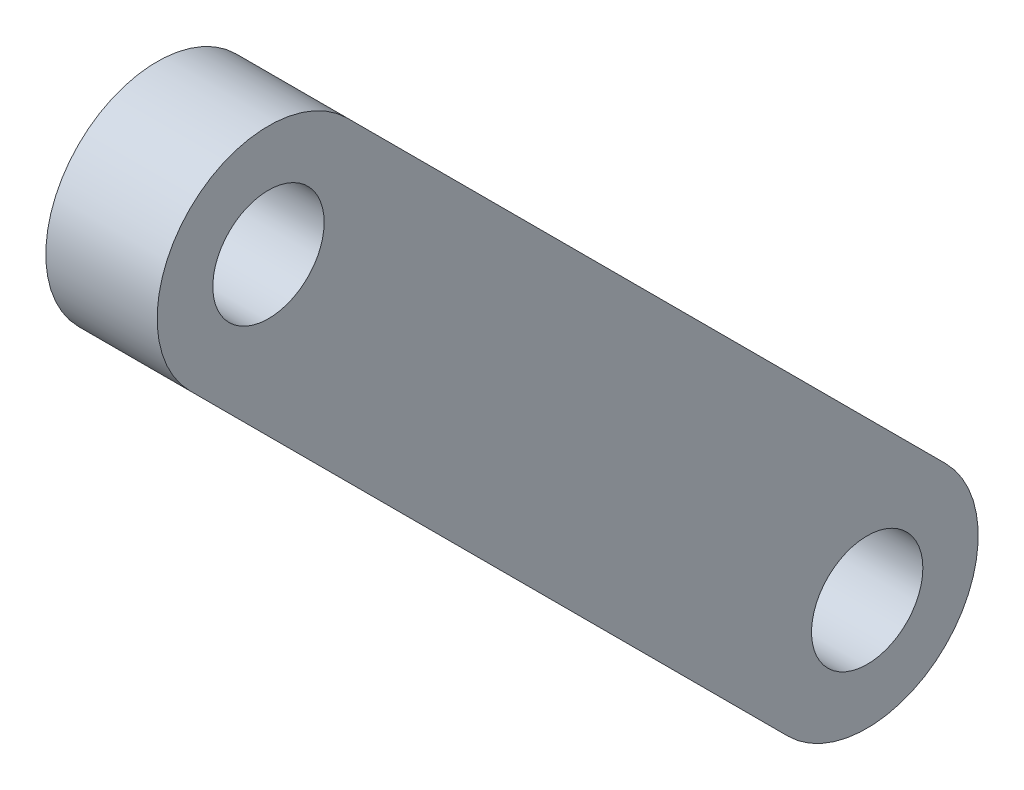
from build123d import *

# Parameters (mm, degrees)
SKETCH1_R           = 2.5
BOSS_EXTRUDE1_DEPTH = 5


with BuildPart() as part:
    # Sketch1 → Boss-Extrude1 (new body)
    with BuildSketch(Plane(origin=(0, 0, 0), x_dir=(0, 0, -1), z_dir=(1, 0, 0))):
        with BuildLine():
            Line((32.973972115, 3.535533906), (59.8440298, -23.334523779))
            ThreePointArc((59.8440298, -23.334523779), (59.8440298, -30.405591591), (52.772961988, -30.405591591))
            Line((52.772961988, -30.405591591), (25.902904303, -3.535533906))
            ThreePointArc((25.902904303, -3.535533906), (25.902904303, 3.535533906), (32.973972115, 3.535533906))
        make_face()
        with Locations((29.438438209, 0)):
            Circle(SKETCH1_R, mode=Mode.SUBTRACT)
        with Locations((56.323505195, -26.885066985)):
            Circle(SKETCH1_R, mode=Mode.SUBTRACT)
    extrude(amount=BOSS_EXTRUDE1_DEPTH)


solid = part.part
